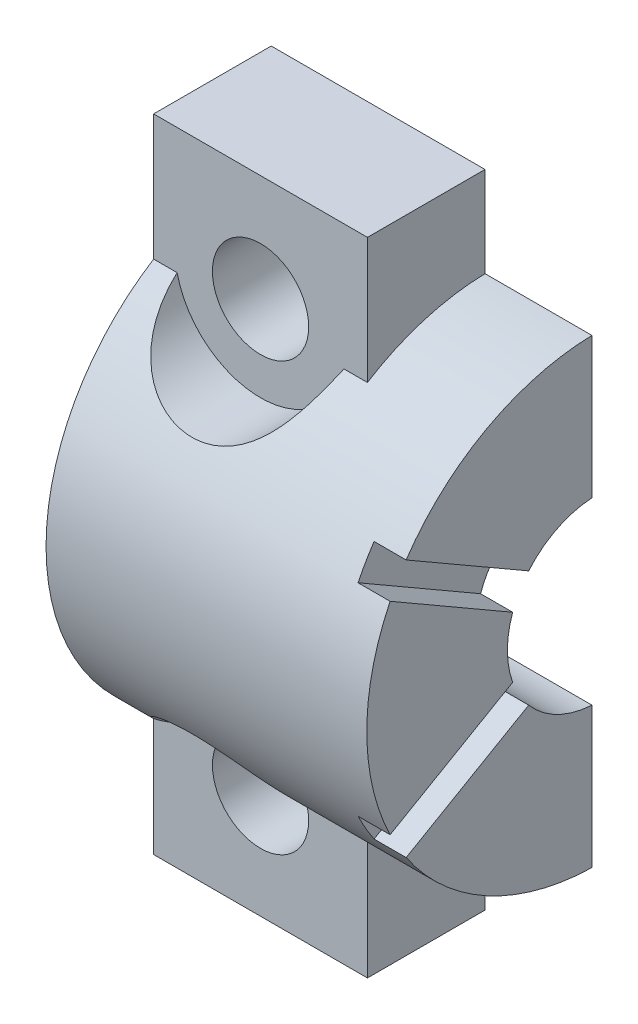
from build123d import *
from build123d.topology import SkipClean

# Parameters (mm, degrees)
SKETCH1_W                      = 10
SKETCH1_H                      = 30
BOSS_EXTRUDE1_DEPTH            = 5.5
SKETCH2_R                      = 4.205
CUT_EXTRUDE1_DEPTH             = 19.848077
BOSS_EXTRUDE2_START            = -10
BOSS_EXTRUDE2_DEPTH            = 15
CUT_EXTRUDE_THIN1_DEPTH        = 24.683484
CUT_EXTRUDE_THIN1_DEPTH_BACK   = 1.5
CUT_EXTRUDE_THIN2_DEPTH        = 24.683484
CUT_EXTRUDE_THIN2_DEPTH_BACK   = 1.5
CBORE_FOR_M4_SHCS1_D           = 4.5
CBORE_FOR_M4_SHCS1_CBORE_D     = 8
CBORE_FOR_M4_SHCS1_CBORE_DEPTH = 4
SKETCH22_R                     = 4
CUT_EXTRUDE2_DEPTH             = 1.03126


with BuildPart() as part:
    # Sketch1 → Boss-Extrude1 (new body)
    with BuildSketch(Plane.XY):
        Rectangle(SKETCH1_W, SKETCH1_H)
    extrude(amount=BOSS_EXTRUDE1_DEPTH)

    # Sketch2 → Cut-Extrude1 (cut, through all)
    with BuildSketch(Plane(origin=(5, 0, 0), x_dir=(0, 0, -1), z_dir=(1, 0, 0))):
        with Locations((0.25, 0)):
            Circle(SKETCH2_R)
    extrude(amount=-CUT_EXTRUDE1_DEPTH, mode=Mode.SUBTRACT)

    # Sketch9 → Boss-Extrude2 (add)
    with SkipClean():  # the faces are left unmerged after this step: merging them gives an invalid solid
        with BuildSketch(Plane(origin=(5, 0, 0), x_dir=(0, 0, -1), z_dir=(1, 0, 0)).offset(BOSS_EXTRUDE2_START)):
            with BuildLine():
                ThreePointArc((-5.5, -9.119927), (-2.862491, -10.322207), (0, -10.778361))
                Line((0, -10.778361), (0, -4.197562))
                ThreePointArc((0, -4.197562), (-3.955, 0), (0, 4.197562))
                Line((0, 4.197562), (0, 10.778361))
                ThreePointArc((0, 10.778361), (-2.862491, 10.322207), (-5.5, 9.119927))
                Line((-5.5, 9.119927), (-5.5, -9.119927))
            make_face()
            with BuildLine():
                ThreePointArc((-5.5, 9.119927), (-10.53126, 0), (-5.5, -9.119927))
                Line((-5.5, -9.119927), (-5.5, 9.119927))
            make_face()
        extrude(amount=BOSS_EXTRUDE2_DEPTH)

    # Sketch12 → Cut-Extrude-Thin1 (cut, two sides: drawn at the far end of the back side and taken through both)
    with SkipClean():  # the faces are left unmerged after this step: merging them gives an invalid solid
        with BuildSketch(Plane(origin=(10, 0, 0), x_dir=(0, 0, -1), z_dir=(1, 0, 0)).offset(-CUT_EXTRUDE_THIN1_DEPTH_BACK)):
            Polygon((-0.125, 0.649519), (-9.461845, -4.741111), (-8.711845, -6.040149), (0.625, -0.649519), align=None)
        extrude(amount=CUT_EXTRUDE_THIN1_DEPTH + CUT_EXTRUDE_THIN1_DEPTH_BACK, mode=Mode.SUBTRACT)

    # Sketch21 → Cut-Extrude-Thin2 (cut, two sides: drawn at the far end of the back side and taken through both)
    with SkipClean():  # the faces are left unmerged after this step: merging them gives an invalid solid
        with BuildSketch(Plane(origin=(10, 0, 0), x_dir=(0, 0, -1), z_dir=(1, 0, 0)).offset(-CUT_EXTRUDE_THIN2_DEPTH_BACK)):
            Polygon((0.625, 0.649519), (-8.711845, 6.040149), (-9.461845, 4.741111), (-0.125, -0.649519), align=None)
        extrude(amount=CUT_EXTRUDE_THIN2_DEPTH + CUT_EXTRUDE_THIN2_DEPTH_BACK, mode=Mode.SUBTRACT)

    # CBORE for M4 SHCS1 (through all)
    with Locations(Plane.XY.offset(10.53126)):
        with Locations((0, 10), (0, -10)):
            CounterBoreHole(CBORE_FOR_M4_SHCS1_D / 2, CBORE_FOR_M4_SHCS1_CBORE_D / 2, CBORE_FOR_M4_SHCS1_CBORE_DEPTH)

    # Sketch22 → Cut-Extrude2 (cut)
    with SkipClean():  # the faces are left unmerged after this step: merging them gives an invalid solid
        with BuildSketch(Plane.XY.offset(6.53126)):
            with Locations((0, 10)):
                Circle(SKETCH22_R)
            with Locations((0, -10)):
                Circle(SKETCH22_R)
        extrude(amount=-CUT_EXTRUDE2_DEPTH, mode=Mode.SUBTRACT)


solid = part.part
